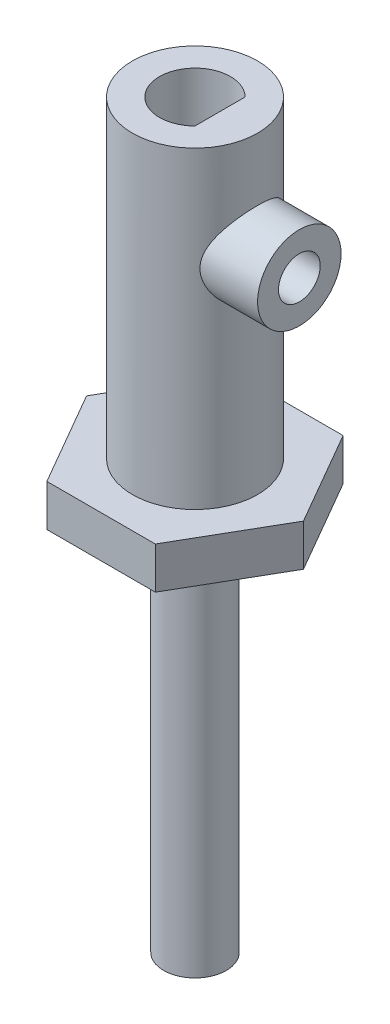
from build123d import *

# Parameters (mm, degrees)
SKETCH1_R                = 3
BOSS_EXTRUDE1_DEPTH      = 17
CUT_EXTRUDE3_DEPTH       = 10.2
BOSS_EXTRUDE2_DEPTH      = 2
SKETCH4_R                = 1.5
BOSS_EXTRUDE3_DEPTH      = 18.5
BOSS_EXTRUDE4_DEPTH      = 2
BOSS_EXTRUDE4_DEPTH_BACK = 1
SKETCH6_R                = 2
SKETCH6_R_2              = 1
SKETCH7_R                = 1.1
CUT_EXTRUDE4_DEPTH       = 3


with BuildPart() as part:
    # Sketch1 → Boss-Extrude1 (new body)
    with BuildSketch(Plane(origin=(0, 0, 0), x_dir=(1, 0, 0), z_dir=(0, 1, 0))):
        with Locations(Location((0, 0, 0), (0, 0, 270))):
            Circle(SKETCH1_R)
    extrude(amount=BOSS_EXTRUDE1_DEPTH)

    # Sketch2 → Cut-Extrude3 (cut)
    with BuildSketch(Plane(origin=(0, 17, 0), x_dir=(1, 0, 0), z_dir=(0, 1, 0))):
        with BuildLine():
            Line((1.2, 1.204159458), (1.2, -1.204159458))
            ThreePointArc((1.2, -1.204159458), (-1.7, 0), (1.2, 1.204159458))
        make_face()
    extrude(amount=-CUT_EXTRUDE3_DEPTH, mode=Mode.SUBTRACT)

    # Sketch3 → Boss-Extrude2 (add)
    with BuildSketch(Plane(origin=(0, 0, 0), x_dir=(-1, 0, 0), z_dir=(0, -1, 0))):
        Polygon((5.196152423, 0), (2.598076211, 4.5), (-2.598076211, 4.5), (-5.196152423, 0), (-2.598076211, -4.5), (2.598076211, -4.5), align=None)
    extrude(amount=-BOSS_EXTRUDE2_DEPTH)

    # Sketch4 → Boss-Extrude3 (add)
    with BuildSketch(Plane(origin=(0, 0, 0), x_dir=(-1, 0, 0), z_dir=(0, -1, 0))):
        with Locations(Location((0, 0, 0), (0, 0, 90))):
            Circle(SKETCH4_R)
    extrude(amount=BOSS_EXTRUDE3_DEPTH)

    # Sketch6 → Boss-Extrude4 (add, two sides: drawn at the far end of the back side and taken through both)
    with BuildSketch(Plane(origin=(3, 0, 0), x_dir=(0, 0, -1), z_dir=(1, 0, 0)).offset(-BOSS_EXTRUDE4_DEPTH_BACK)):
        with Locations((0, 12)):
            Circle(SKETCH6_R)
        with Locations((0, 12)):
            Circle(SKETCH6_R_2, mode=Mode.SUBTRACT)
    extrude(amount=BOSS_EXTRUDE4_DEPTH + BOSS_EXTRUDE4_DEPTH_BACK)

    # Sketch7 → Cut-Extrude4 (cut)
    with BuildSketch(Plane(origin=(3, 0, 0), x_dir=(0, 0, -1), z_dir=(1, 0, 0))):
        with Locations((0, 12)):
            Circle(SKETCH7_R)
    extrude(amount=-CUT_EXTRUDE4_DEPTH, mode=Mode.SUBTRACT)


solid = part.part
